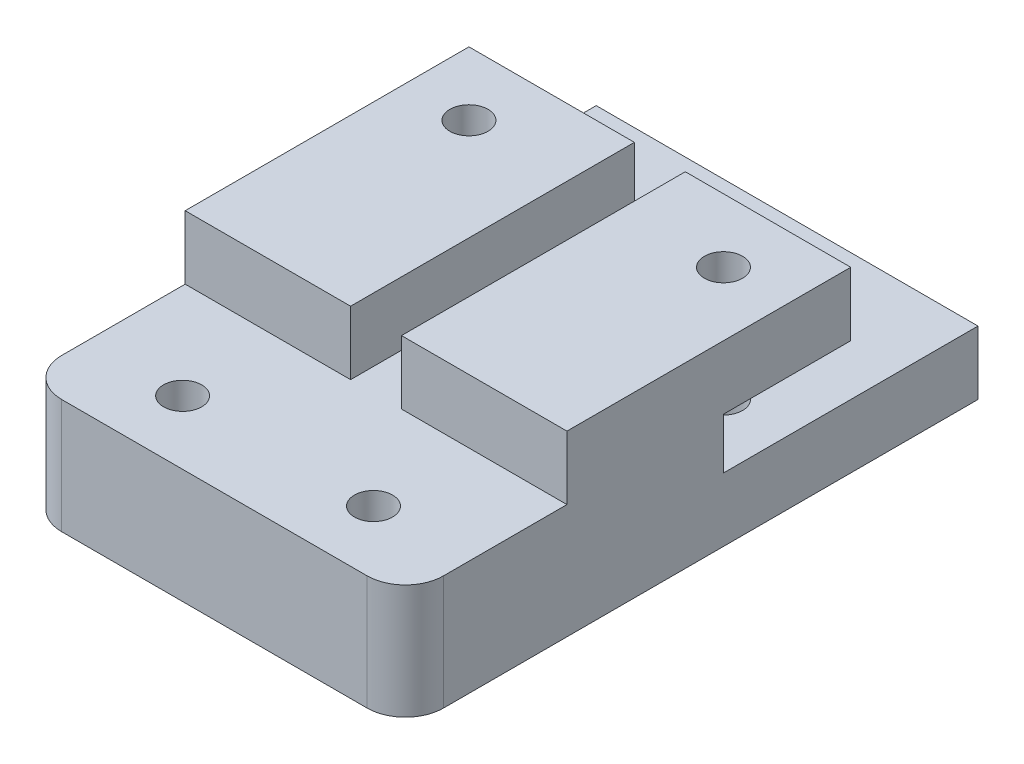
from build123d import *

# Parameters (mm, degrees)
CROQUIS1_W              = 30
CROQUIS1_H              = 35
CROQUIS1_R              = 1.5
SALIENTE_EXTRUIR1_DEPTH = 20
CROQUIS2_W              = 10
CROQUIS2_H              = 4
CORTAR_EXTRUIR1_DEPTH   = 41
CORTAR_EXTRUIR2_DEPTH   = 8
CORTAR_EXTRUIR3_DEPTH   = 8
CROQUIS6_W              = 30
CROQUIS6_H              = 11
SALIENTE_EXTRUIR2_DEPTH = 10
CORTAR_EXTRUIR4_START   = -30
CROQUIS7_W              = 45
CROQUIS7_H              = 6
CORTAR_EXTRUIR4_DEPTH   = 30
CORTAR_EXTRUIR5_REACH   = 52.249
CROQUIS8_W              = 4
CROQUIS8_H              = 5
CORTAR_EXTRUIR6_START   = -30
CROQUIS9_W              = 12.7
CROQUIS9_H              = 5
CORTAR_EXTRUIR6_DEPTH   = 30
REDONDEO1_R             = 3


with BuildPart() as part:
    # Croquis1 → Saliente-Extruir1 (new body)
    with BuildSketch(Plane(origin=(0, 0, 0), x_dir=(1, 0, 0), z_dir=(0, 1, 0))):
        with Locations((15, 17.5)):
            Rectangle(CROQUIS1_W, CROQUIS1_H)
        with Locations(Location((25, 30, 0), (0, 0, 270))):
            Circle(CROQUIS1_R, mode=Mode.SUBTRACT)
        with Locations(Location((5, 30, 0), (0, 0, 270))):
            Circle(CROQUIS1_R, mode=Mode.SUBTRACT)
        with Locations(Location((7.5, 5, 0), (0, 0, 270))):
            Circle(CROQUIS1_R, mode=Mode.SUBTRACT)
        with Locations(Location((22.5, 5, 0), (0, 0, 270))):
            Circle(CROQUIS1_R, mode=Mode.SUBTRACT)
    extrude(amount=SALIENTE_EXTRUIR1_DEPTH)

    # Croquis2 → Cortar-Extruir1 (cut)
    with BuildSketch(Plane(origin=(30, 0, 0), x_dir=(0, 0, -1), z_dir=(1, 0, 0))):
        with Locations((30, 13)):
            Rectangle(CROQUIS2_W, CROQUIS2_H)
    extrude(amount=-CORTAR_EXTRUIR1_DEPTH, mode=Mode.SUBTRACT)

    # Croquis3 → Cortar-Extruir2 (cut)
    with BuildSketch(Plane.XZ):
        Polygon((5, -33.117691454), (7.7, -31.558845727), (7.7, -28.441154273), (5, -26.882308546), (2.3, -28.441154273), (2.3, -31.558845727), align=None)
        Polygon((25, -33.117691454), (27.7, -31.558845727), (27.7, -28.441154273), (25, -26.882308546), (22.3, -28.441154273), (22.3, -31.558845727), align=None)
    extrude(amount=-CORTAR_EXTRUIR2_DEPTH, mode=Mode.SUBTRACT)

    # Croquis4 → Cortar-Extruir3 (cut)
    with BuildSketch(Plane.XZ):
        Polygon((7.5, -8.117691454), (10.2, -6.558845727), (10.2, -3.441154273), (7.5, -1.882308546), (4.8, -3.441154273), (4.8, -6.558845727), align=None)
        Polygon((22.5, -8.117691454), (25.2, -6.558845727), (25.2, -3.441154273), (22.5, -1.882308546), (19.8, -3.441154273), (19.8, -6.558845727), align=None)
    extrude(amount=-CORTAR_EXTRUIR3_DEPTH, mode=Mode.SUBTRACT)

    # Croquis6 → Saliente-Extruir2 (add)
    with BuildSketch(Plane(origin=(0, 0, -35), x_dir=(-1, 0, 0), z_dir=(0, 0, -1))):
        with Locations((-15, 5.5)):
            Rectangle(CROQUIS6_W, CROQUIS6_H)
    extrude(amount=SALIENTE_EXTRUIR2_DEPTH)

    # Croquis7 → Cortar-Extruir4 (cut)
    with BuildSketch(Plane.ZY.offset(CORTAR_EXTRUIR4_START)):
        with Locations((-22.5, 3)):
            Rectangle(CROQUIS7_W, CROQUIS7_H)
    extrude(amount=CORTAR_EXTRUIR4_DEPTH, mode=Mode.SUBTRACT)

    # Cortar-Extruir5: up to this face of the body (flat: up to its plane)
    cortar_extruir5_end = Plane(part.part.faces().sort_by_distance((15, 13, 0))[0])
    # Croquis8 → Cortar-Extruir5 (cut, up to the picked face)
    with BuildSketch(Plane(origin=(0, 0, -35), x_dir=(-1, 0, 0), z_dir=(0, 0, -1)), mode=Mode.PRIVATE) as cortar_extruir5_sk1:
        with Locations((-15, 17.5)):
            Rectangle(CROQUIS8_W, CROQUIS8_H)
    cortar_extruir5_tool1 = split(extrude(cortar_extruir5_sk1.sketch, amount=-CORTAR_EXTRUIR5_REACH, mode=Mode.PRIVATE), bisect_by=cortar_extruir5_end, keep=Keep.BOTH, mode=Mode.PRIVATE)
    add(cortar_extruir5_tool1.solids().sort_by(Axis((15, 17.5, -35), (0, 0, 1)))[0], mode=Mode.SUBTRACT)

    # Croquis9 → Cortar-Extruir6 (cut)
    with BuildSketch(Plane.ZY.offset(CORTAR_EXTRUIR6_START)):
        with Locations((-6.35, 17.5)):
            Rectangle(CROQUIS9_W, CROQUIS9_H)
    extrude(amount=CORTAR_EXTRUIR6_DEPTH, mode=Mode.SUBTRACT)

    # Redondeo1
    redondeo1_edges = [part.edges().sort_by_distance(p)[0] for p in [
        (30, 10.5, 0),
        (0, 10.5, 0),
    ]]
    fillet(redondeo1_edges, radius=REDONDEO1_R)


solid = part.part
